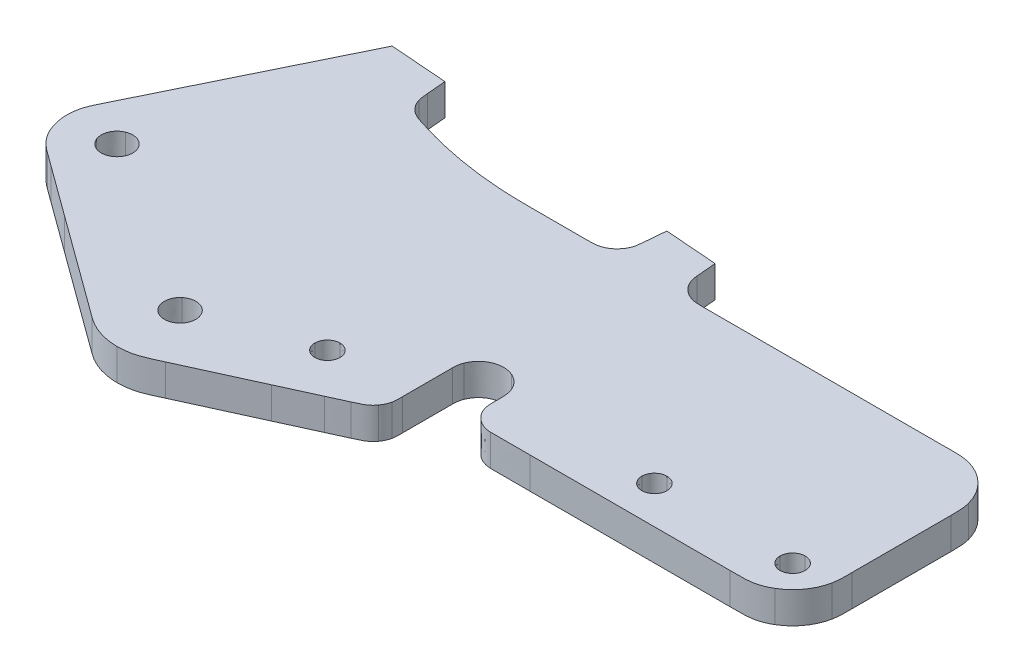
from build123d import *

# Parameters (mm, degrees)
BOSS_EXTRUDE1_DEPTH                       = 7.9375
M6X1_0_TAPPED_HOLE5_D                     = 5
M6X1_0_TAPPED_HOLE5_DEPTH                 = 12.0000014
M6X1_0_TAPPED_HOLE5_CSINK_D               = 6.05
M6X1_0_TAPPED_HOLE5_CSINK_ANGLE           = 90
M6X1_0_TAPPED_HOLE5_TIP                   = 1.502151548
M6X1_0_TAPPED_HOLE5_ON_FACE_2_D           = 5
M6X1_0_TAPPED_HOLE5_ON_FACE_2_DEPTH       = 12.0000014
M6X1_0_TAPPED_HOLE5_ON_FACE_2_CSINK_D     = 6.05
M6X1_0_TAPPED_HOLE5_ON_FACE_2_CSINK_ANGLE = 90
M6X1_0_TAPPED_HOLE5_ON_FACE_2_TIP         = 1.502151548


with BuildPart() as part:
    # Sketch1 → Boss-Extrude1 (new body)
    with BuildSketch(Plane(origin=(0, 0, 0), x_dir=(1, 0, 0), z_dir=(0, 1, 0))):
        with BuildLine():
            Line((26.254202, 100.7033038), (40.6891744, 99.5939334))
            add(Edge.make_bspline(
                [(40.6891744, 99.5939334), (40.833802, 97.9678508), (40.9716478, 96.3486516), (41.1163516, 94.7225944)],
                knots=[0, 0, 0, 0, 1, 1, 1, 1], degree=3))
            add(Edge.make_bspline(
                [(41.1163516, 94.7225944), (41.1853126, 93.9164492), (41.2197042, 93.1171874), (41.4539684, 92.3316924)],
                knots=[0, 0, 0, 0, 1, 1, 1, 1], degree=3))
            add(Edge.make_bspline(
                [(41.4539684, 92.3316924), (41.6951414, 91.4979882), (42.074084, 90.7882868), (42.6184314, 90.1130532)],
                knots=[0, 0, 0, 0, 1, 1, 1, 1], degree=3))
            add(Edge.make_bspline(
                [(42.6184314, 90.1130532), (43.7690768, 88.7005846), (45.2091298, 88.1906796), (46.8214456, 87.6808)],
                knots=[0, 0, 0, 0, 1, 1, 1, 1], degree=3))
            add(Edge.make_bspline(
                [(46.8214456, 87.6808), (48.3717346, 87.1778546), (49.9357904, 86.723093), (51.5205472, 86.3027992)],
                knots=[0, 0, 0, 0, 1, 1, 1, 1], degree=3))
            add(Edge.make_bspline(
                [(51.5205472, 86.3027992), (57.9077582, 84.6008976), (64.308736, 83.546696), (70.9026522, 83.105752)],
                knots=[0, 0, 0, 0, 1, 1, 1, 1], degree=3))
            add(Edge.make_bspline(
                [(70.9026522, 83.105752), (74.1823764, 82.8852546), (77.4552172, 82.8782442), (80.7349414, 82.8782442)],
                knots=[0, 0, 0, 0, 1, 1, 1, 1], degree=3))
            add(Edge.make_bspline(
                [(80.7349414, 82.8782442), (84.014691, 82.8782442), (87.2944152, 82.8782442), (90.5741648, 82.8782442)],
                knots=[0, 0, 0, 0, 1, 1, 1, 1], degree=3))
            add(Edge.make_bspline(
                [(90.5741648, 82.8782442), (91.1460458, 82.8782442), (94.7840624, 82.8582544), (95.355918, 82.9332352)],
                knots=[0, 0, 0, 0, 1, 1, 1, 1], degree=3))
            add(Edge.make_bspline(
                [(95.355918, 82.9332352), (97.0440528, 83.1467476), (98.5736662, 84.0356968), (99.6071922, 85.3930474)],
                knots=[0, 0, 0, 0, 1, 1, 1, 1], degree=3))
            add(Edge.make_bspline(
                [(99.6071922, 85.3930474), (100.8129556, 86.9778042), (100.8336312, 88.1973344), (100.9921272, 90.037031)],
                knots=[0, 0, 0, 0, 1, 1, 1, 1], degree=3))
            add(Edge.make_bspline(
                [(100.9921272, 90.037031), (101.1367802, 91.669997), (101.2815094, 93.2960796), (101.4193298, 94.9221368)],
                knots=[0, 0, 0, 0, 1, 1, 1, 1], degree=3))
            Line((101.4193298, 94.9221368), (114.6416046, 93.9092864))
            add(Edge.make_bspline(
                [(114.6416046, 93.9092864), (114.7862576, 92.2349946), (114.9310122, 90.5675354), (115.0756652, 88.8932436)],
                knots=[0, 0, 0, 0, 1, 1, 1, 1], degree=3))
            add(Edge.make_bspline(
                [(115.0756652, 88.8932436), (115.2480042, 86.9984544), (115.8335758, 85.6411038), (117.3080966, 84.3939384)],
                knots=[0, 0, 0, 0, 1, 1, 1, 1], degree=3))
            add(Edge.make_bspline(
                [(117.3080966, 84.3939384), (118.7687998, 83.1537326), (120.2570874, 82.8781426), (122.076083, 82.8781426)],
                knots=[0, 0, 0, 0, 1, 1, 1, 1], degree=3))
            add(Edge.make_bspline(
                [(122.076083, 82.8781426), (123.757309, 82.8781426), (125.4316262, 82.8781426), (127.1128268, 82.8781426)],
                knots=[0, 0, 0, 0, 1, 1, 1, 1], degree=3))
            add(Edge.make_bspline(
                [(127.1128268, 82.8781426), (133.8307458, 82.8781426), (140.5486902, 82.8781426), (147.2666346, 82.8781426)],
                knots=[0, 0, 0, 0, 1, 1, 1, 1], degree=3))
            add(Edge.make_bspline(
                [(147.2666346, 82.8781426), (154.0190214, 82.8781426), (160.7782916, 82.8781426), (167.5306784, 82.8781426)],
                knots=[0, 0, 0, 0, 1, 1, 1, 1], degree=3))
            add(Edge.make_bspline(
                [(167.5306784, 82.8781426), (170.9068972, 82.8781426), (174.2830652, 82.8781426), (177.6661674, 82.8781426)],
                knots=[0, 0, 0, 0, 1, 1, 1, 1], degree=3))
            add(Edge.make_bspline(
                [(177.6661674, 82.8781426), (179.3542514, 82.8781426), (181.0423608, 82.8781426), (182.7304448, 82.8781426)],
                knots=[0, 0, 0, 0, 1, 1, 1, 1], degree=3))
            add(Edge.make_bspline(
                [(182.7304448, 82.8781426), (184.3978786, 82.8781426), (186.0653124, 82.9676522), (187.7327208, 82.8431414)],
                knots=[0, 0, 0, 0, 1, 1, 1, 1], degree=3))
            add(Edge.make_bspline(
                [(187.7327208, 82.8431414), (191.2467346, 82.5881508), (194.4920164, 80.8931834), (196.7106302, 78.1508978)],
                knots=[0, 0, 0, 0, 1, 1, 1, 1], degree=3))
            add(Edge.make_bspline(
                [(196.7106302, 78.1508978), (197.8475088, 76.7384546), (198.6054448, 75.2570504), (199.0808566, 73.5069396)],
                knots=[0, 0, 0, 0, 1, 1, 1, 1], degree=3))
            add(Edge.make_bspline(
                [(199.0808566, 73.5069396), (199.521826, 71.8877404), (199.521826, 70.2891914), (199.521826, 68.649342)],
                knots=[0, 0, 0, 0, 1, 1, 1, 1], degree=3))
            add(Edge.make_bspline(
                [(199.521826, 68.649342), (199.521826, 61.993399), (199.521826, 55.3236892), (199.521826, 48.6608882)],
                knots=[0, 0, 0, 0, 1, 1, 1, 1], degree=3))
            add(Edge.make_bspline(
                [(199.521826, 48.6608882), (199.521826, 46.9934798), (199.521826, 45.326046), (199.521826, 43.6654956)],
                knots=[0, 0, 0, 0, 1, 1, 1, 1], degree=3))
            add(Edge.make_bspline(
                [(199.521826, 43.6654956), (199.521826, 42.0325296), (199.5976704, 40.4202392), (199.2668608, 38.7941312)],
                knots=[0, 0, 0, 0, 1, 1, 1, 1], degree=3))
            add(Edge.make_bspline(
                [(199.2668608, 38.7941312), (198.5433926, 35.2870516), (196.3798714, 32.2484496), (193.299969, 30.4225452)],
                knots=[0, 0, 0, 0, 1, 1, 1, 1], degree=3))
            add(Edge.make_bspline(
                [(193.299969, 30.4225452), (189.8273064, 28.3692854), (187.3192596, 28.6449008), (183.598566, 28.6449008)],
                knots=[0, 0, 0, 0, 1, 1, 1, 1], degree=3))
            add(Edge.make_bspline(
                [(183.598566, 28.6449008), (180.2706072, 28.6449008), (176.9357396, 28.6449008), (173.6078062, 28.6449008)],
                knots=[0, 0, 0, 0, 1, 1, 1, 1], degree=3))
            add(Edge.make_bspline(
                [(173.6078062, 28.6449008), (160.0961238, 28.6449008), (146.5844668, 28.6449008), (133.0728098, 28.6449008)],
                knots=[0, 0, 0, 0, 1, 1, 1, 1], degree=3))
            add(Edge.make_bspline(
                [(133.0728098, 28.6449008), (129.7723846, 28.6449008), (126.4720102, 28.568904), (123.1647016, 28.6499046)],
                knots=[0, 0, 0, 0, 1, 1, 1, 1], degree=3))
            add(Edge.make_bspline(
                [(123.1647016, 28.6499046), (121.4352664, 28.6898842), (119.8023004, 29.4353996), (118.630954, 30.7169312)],
                knots=[0, 0, 0, 0, 1, 1, 1, 1], degree=3))
            add(Edge.make_bspline(
                [(118.630954, 30.7169312), (117.3631638, 32.115633), (116.9773124, 33.5350358), (116.9773124, 35.3609402)],
                knots=[0, 0, 0, 0, 1, 1, 1, 1], degree=3))
            add(Edge.make_bspline(
                [(116.9773124, 35.3609402), (116.9773124, 36.7389918), (117.1013152, 38.854253), (116.6121112, 40.239188)],
                knots=[0, 0, 0, 0, 1, 1, 1, 1], degree=3))
            add(Edge.make_bspline(
                [(116.6121112, 40.239188), (116.0195546, 41.9272974), (114.744881, 43.284648), (113.0981228, 43.9805318)],
                knots=[0, 0, 0, 0, 1, 1, 1, 1], degree=3))
            add(Edge.make_bspline(
                [(113.0981228, 43.9805318), (109.7839308, 45.3792336), (105.994327, 43.7670448), (104.6989778, 40.4114508)],
                knots=[0, 0, 0, 0, 1, 1, 1, 1], degree=3))
            add(Edge.make_bspline(
                [(104.6989778, 40.4114508), (104.38892, 39.612189), (104.2717752, 38.8197852), (104.2717752, 37.9722888)],
                knots=[0, 0, 0, 0, 1, 1, 1, 1], degree=3))
            add(Edge.make_bspline(
                [(104.2717752, 37.9722888), (104.2717752, 37.1248432), (104.2717752, 36.2841794), (104.2717752, 35.4435918)],
                knots=[0, 0, 0, 0, 1, 1, 1, 1], degree=3))
            add(Edge.make_bspline(
                [(104.2717752, 35.4435918), (104.2717752, 33.7555332), (104.2717752, 32.0674492), (104.2717752, 30.3793398)],
                knots=[0, 0, 0, 0, 1, 1, 1, 1], degree=3))
            add(Edge.make_bspline(
                [(104.2717752, 30.3793398), (104.2717752, 28.6912304), (104.2717752, 27.0031464), (104.2717752, 25.315037)],
                knots=[0, 0, 0, 0, 1, 1, 1, 1], degree=3))
            add(Edge.make_bspline(
                [(104.2717752, 25.315037), (104.2717752, 24.4813328), (104.3132788, 23.6544866), (104.134031, 22.813899)],
                knots=[0, 0, 0, 0, 1, 1, 1, 1], degree=3))
            add(Edge.make_bspline(
                [(104.134031, 22.813899), (103.9410672, 21.9319348), (103.6034758, 21.1740496), (103.0798294, 20.4436472)],
                knots=[0, 0, 0, 0, 1, 1, 1, 1], degree=3))
            add(Edge.make_bspline(
                [(103.0798294, 20.4436472), (101.9842766, 18.9209426), (100.4891056, 18.3421528), (98.918141, 17.6255934)],
                knots=[0, 0, 0, 0, 1, 1, 1, 1], degree=3))
            add(Edge.make_bspline(
                [(98.918141, 17.6255934), (97.3885276, 16.9296842), (95.8520054, 16.2268916), (94.3154832, 15.5309824)],
                knots=[0, 0, 0, 0, 1, 1, 1, 1], degree=3))
            add(Edge.make_bspline(
                [(94.3154832, 15.5309824), (91.2424642, 14.1253464), (88.1694452, 12.7266446), (85.1033096, 11.3279428)],
                knots=[0, 0, 0, 0, 1, 1, 1, 1], degree=3))
            add(Edge.make_bspline(
                [(85.1033096, 11.3279428), (78.991714, 8.5442806), (72.8801184, 5.7606946), (66.7754062, 2.9770324)],
                knots=[0, 0, 0, 0, 1, 1, 1, 1], degree=3))
            add(Edge.make_bspline(
                [(66.7754062, 2.9770324), (63.3027436, 1.3991844), (61.187457, 0.1933956), (57.1566802, 0.2209546)],
                knots=[0, 0, 0, 0, 1, 1, 1, 1], degree=3))
            add(Edge.make_bspline(
                [(57.1566802, 0.2209546), (53.7185108, 0.250952), (50.3767344, 1.392301), (47.6413322, 3.480054)],
                knots=[0, 0, 0, 0, 1, 1, 1, 1], degree=3))
            Line((47.6413322, 3.480054), (47.6413576, 3.4826956))
            add(Edge.make_bspline(
                [(47.6413576, 3.4826956), (39.13886, 9.6838516), (30.629479, 15.885033), (22.1269814, 22.086189)],
                knots=[0, 0, 0, 0, 1, 1, 1, 1], degree=3))
            add(Edge.make_bspline(
                [(22.1269814, 22.086189), (17.8826414, 25.1867924), (13.6313672, 28.280487), (9.3870272, 31.3810396)],
                knots=[0, 0, 0, 0, 1, 1, 1, 1], degree=3))
            add(Edge.make_bspline(
                [(9.3870272, 31.3810396), (8.3259422, 32.1527424), (7.2648572, 32.931354), (6.2037722, 33.7030314)],
                knots=[0, 0, 0, 0, 1, 1, 1, 1], degree=3))
            add(Edge.make_bspline(
                [(6.2037722, 33.7030314), (5.1357784, 34.481643), (4.1091612, 35.273996), (3.2409892, 36.2937806)],
                knots=[0, 0, 0, 0, 1, 1, 1, 1], degree=3))
            add(Edge.make_bspline(
                [(3.2409892, 36.2937806), (1.5184374, 38.3194814), (0.4780026, 40.8275028), (0.264414, 43.4802534)],
                knots=[0, 0, 0, 0, 1, 1, 1, 1], degree=3))
            add(Edge.make_bspline(
                [(0.264414, 43.4802534), (0.154178, 44.8306952), (0.250317, 46.1191864), (0.560705, 47.4420946)],
                knots=[0, 0, 0, 0, 1, 1, 1, 1], degree=3))
            add(Edge.make_bspline(
                [(0.560705, 47.4420946), (0.863854, 48.7374438), (1.4082014, 49.9087902), (1.9869658, 51.0939034)],
                knots=[0, 0, 0, 0, 1, 1, 1, 1], degree=3))
            add(Edge.make_bspline(
                [(1.9869658, 51.0939034), (3.14452, 53.4434542), (4.288282, 55.7929796), (5.4458362, 58.1494392)],
                knots=[0, 0, 0, 0, 1, 1, 1, 1], degree=3))
            add(Edge.make_bspline(
                [(5.4458362, 58.1494392), (7.7540612, 62.8761506), (10.0691442, 67.6096946), (12.3773692, 72.3363298)],
                knots=[0, 0, 0, 0, 1, 1, 1, 1], degree=3))
            add(Edge.make_bspline(
                [(12.3773692, 72.3363298), (17.0006772, 81.7897018), (21.6240106, 91.2499318), (26.254202, 100.7033038)],
                knots=[0, 0, 0, 0, 1, 1, 1, 1], degree=3))
        make_face()
        with BuildLine():
            add(Edge.make_bspline(
                [(193.1759916, 38.1334518), (193.1759916, 39.8835372), (191.7566142, 41.3098488), (189.9995946, 41.3098488)],
                knots=[0, 0, 0, 0, 1, 1, 1, 1], degree=3))
            add(Edge.make_bspline(
                [(189.9995946, 41.3098488), (188.2495092, 41.3098488), (186.823223, 39.8835372), (186.823223, 38.1334518)],
                knots=[0, 0, 0, 0, 1, 1, 1, 1], degree=3))
            add(Edge.make_bspline(
                [(186.823223, 38.1334518), (186.823223, 36.3764322), (188.2495092, 34.9570802), (189.9995946, 34.9570802)],
                knots=[0, 0, 0, 0, 1, 1, 1, 1], degree=3))
            add(Edge.make_bspline(
                [(189.9995946, 34.9570802), (191.7566142, 34.9570802), (193.1759916, 36.3764322), (193.1759916, 38.1334518)],
                knots=[0, 0, 0, 0, 1, 1, 1, 1], degree=3))
        make_face(mode=Mode.SUBTRACT)
        with BuildLine():
            add(Edge.make_bspline(
                [(60.3193104, 18.6479942), (58.9137252, 20.3291948), (56.4056784, 20.5496922), (54.7313612, 19.136995)],
                knots=[0, 0, 0, 0, 1, 1, 1, 1], degree=3))
            add(Edge.make_bspline(
                [(54.7313612, 19.136995), (53.0501606, 17.7313844), (52.8296886, 15.2233884), (54.2352738, 13.5490458)],
                knots=[0, 0, 0, 0, 1, 1, 1, 1], degree=3))
            add(Edge.make_bspline(
                [(54.2352738, 13.5490458), (55.6477678, 11.8678452), (58.1557892, 11.6542312), (59.8301064, 13.060045)],
                knots=[0, 0, 0, 0, 1, 1, 1, 1], degree=3))
            add(Edge.make_bspline(
                [(59.8301064, 13.060045), (61.511307, 14.4656302), (61.724921, 16.9736516), (60.3193104, 18.6479942)],
                knots=[0, 0, 0, 0, 1, 1, 1, 1], degree=3))
        make_face(mode=Mode.SUBTRACT)
        with BuildLine():
            add(Edge.make_bspline(
                [(87.8042948, 25.965404), (87.8042948, 27.7154894), (86.3849174, 29.1348922), (84.6348066, 29.1348922)],
                knots=[0, 0, 0, 0, 1, 1, 1, 1], degree=3))
            add(Edge.make_bspline(
                [(84.6348066, 29.1348922), (82.8778124, 29.1348922), (81.458435, 27.7154894), (81.458435, 25.965404)],
                knots=[0, 0, 0, 0, 1, 1, 1, 1], degree=3))
            add(Edge.make_bspline(
                [(81.458435, 25.965404), (81.458435, 24.2083844), (82.8778124, 22.7889816), (84.6348066, 22.7889816)],
                knots=[0, 0, 0, 0, 1, 1, 1, 1], degree=3))
            add(Edge.make_bspline(
                [(84.6348066, 22.7889816), (86.3849174, 22.7889816), (87.8042948, 24.2083844), (87.8042948, 25.965404)],
                knots=[0, 0, 0, 0, 1, 1, 1, 1], degree=3))
        make_face(mode=Mode.SUBTRACT)
        with BuildLine():
            add(Edge.make_bspline(
                [(158.2495946, 38.1334518), (158.2495946, 39.8835372), (156.8302426, 41.3098488), (155.073223, 41.3098488)],
                knots=[0, 0, 0, 0, 1, 1, 1, 1], degree=3))
            add(Edge.make_bspline(
                [(155.073223, 41.3098488), (153.3231376, 41.3098488), (151.8968514, 39.8835372), (151.8968514, 38.1334518)],
                knots=[0, 0, 0, 0, 1, 1, 1, 1], degree=3))
            add(Edge.make_bspline(
                [(151.8968514, 38.1334518), (151.8968514, 36.3764322), (153.3231376, 34.9570802), (155.073223, 34.9570802)],
                knots=[0, 0, 0, 0, 1, 1, 1, 1], degree=3))
            add(Edge.make_bspline(
                [(155.073223, 34.9570802), (156.8302426, 34.9570802), (158.2495946, 36.3764322), (158.2495946, 38.1334518)],
                knots=[0, 0, 0, 0, 1, 1, 1, 1], degree=3))
        make_face(mode=Mode.SUBTRACT)
        with BuildLine():
            add(Edge.make_bspline(
                [(16.5803834, 46.0433928), (15.7397958, 48.0621848), (13.4177786, 49.0268514), (11.3989612, 48.1862384)],
                knots=[0, 0, 0, 0, 1, 1, 1, 1], degree=3))
            add(Edge.make_bspline(
                [(11.3989612, 48.1862384), (9.373235, 47.3525342), (8.4086192, 45.0305424), (9.2492322, 43.0048416)],
                knots=[0, 0, 0, 0, 1, 1, 1, 1], degree=3))
            add(Edge.make_bspline(
                [(9.2492322, 43.0048416), (10.0898198, 40.97909), (12.411837, 40.0144488), (14.4306544, 40.8550872)],
                knots=[0, 0, 0, 0, 1, 1, 1, 1], degree=3))
            add(Edge.make_bspline(
                [(14.4306544, 40.8550872), (16.4563806, 41.6957002), (17.4209964, 44.017692), (16.5803834, 46.0433928)],
                knots=[0, 0, 0, 0, 1, 1, 1, 1], degree=3))
        make_face(mode=Mode.SUBTRACT)
    extrude(amount=BOSS_EXTRUDE1_DEPTH)

    # M6x1.0 Tapped Hole5
    with Locations(Plane(origin=(108.0304672, 3.96875, -94.4157116), x_dir=(-0.997078929104, 0, -0.076378067122), z_dir=(0.076378067122, 0, -0.997078929104))):
        with Locations((0, 0)):
            CounterSinkHole(M6X1_0_TAPPED_HOLE5_D / 2, M6X1_0_TAPPED_HOLE5_CSINK_D / 2, depth=M6X1_0_TAPPED_HOLE5_DEPTH, counter_sink_angle=M6X1_0_TAPPED_HOLE5_CSINK_ANGLE)
            with Locations((0, 0, -(M6X1_0_TAPPED_HOLE5_DEPTH + M6X1_0_TAPPED_HOLE5_TIP / 2))):  # 118° drill point
                Cone(0, M6X1_0_TAPPED_HOLE5_D / 2, M6X1_0_TAPPED_HOLE5_TIP, mode=Mode.SUBTRACT)

    # M6x1.0 Tapped Hole5 on face 2
    with Locations(Plane(origin=(34.08075339, 3.96875, -100.101810135), x_dir=(-0.997059830136, 0, -0.076626986945), z_dir=(0.076626986945, 0, -0.997059830136))):
        with Locations((0, 0)):
            CounterSinkHole(M6X1_0_TAPPED_HOLE5_ON_FACE_2_D / 2, M6X1_0_TAPPED_HOLE5_ON_FACE_2_CSINK_D / 2, depth=M6X1_0_TAPPED_HOLE5_ON_FACE_2_DEPTH, counter_sink_angle=M6X1_0_TAPPED_HOLE5_ON_FACE_2_CSINK_ANGLE)
            with Locations((0, 0, -(M6X1_0_TAPPED_HOLE5_ON_FACE_2_DEPTH + M6X1_0_TAPPED_HOLE5_ON_FACE_2_TIP / 2))):  # 118° drill point
                Cone(0, M6X1_0_TAPPED_HOLE5_ON_FACE_2_D / 2, M6X1_0_TAPPED_HOLE5_ON_FACE_2_TIP, mode=Mode.SUBTRACT)


solid = part.part
